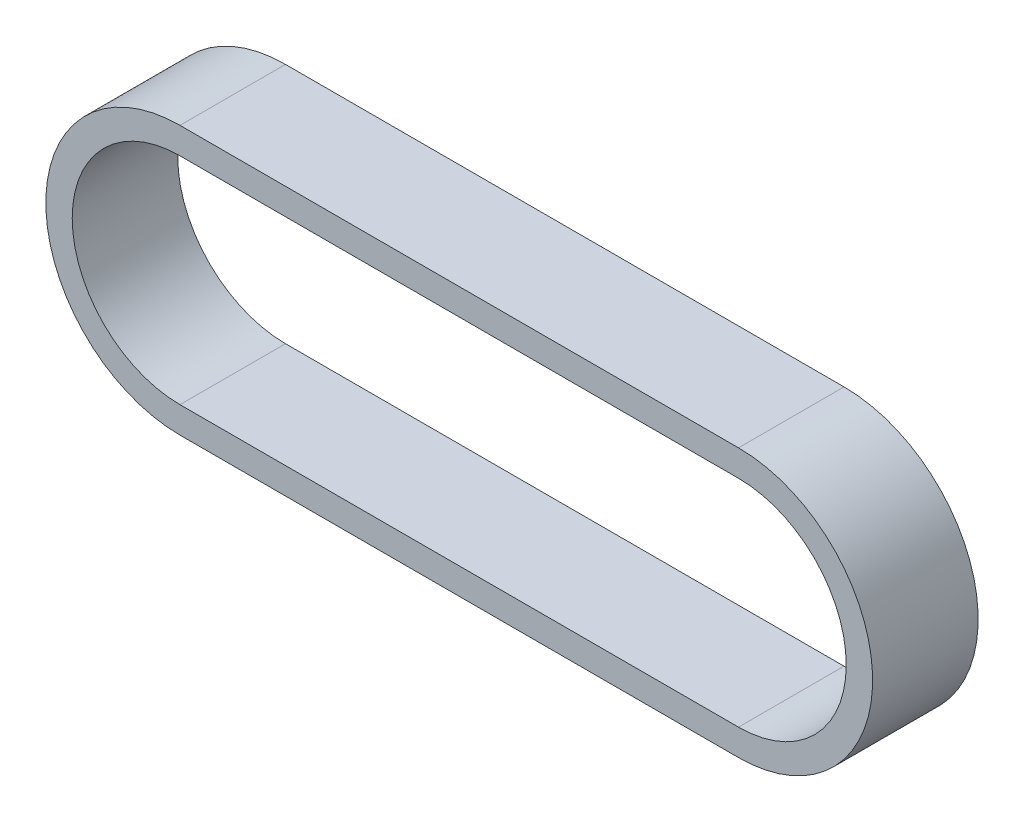
from build123d import *

# Parameters (mm, degrees)
BOSS_EXTRUDE1_DEPTH = 6


with BuildPart() as part:
    # Sketch4 → Boss-Extrude1 (new body)
    with BuildSketch(Plane.XY):
        with BuildLine():
            Line((0, 7.625), (31.75, 7.625))
            ThreePointArc((31.75, 7.625), (39.375, 0), (31.75, -7.625))
            Line((31.75, -7.625), (0, -7.625))
            ThreePointArc((0, -7.625), (-7.625, 0), (0, 7.625))
        make_face()
        with BuildLine():
            Line((0, 6.125), (31.75, 6.125))
            ThreePointArc((31.75, 6.125), (37.875, 0), (31.75, -6.125))
            Line((31.75, -6.125), (0, -6.125))
            ThreePointArc((0, -6.125), (-6.125, 0), (0, 6.125))
        make_face(mode=Mode.SUBTRACT)
    extrude(amount=BOSS_EXTRUDE1_DEPTH)


solid = part.part
